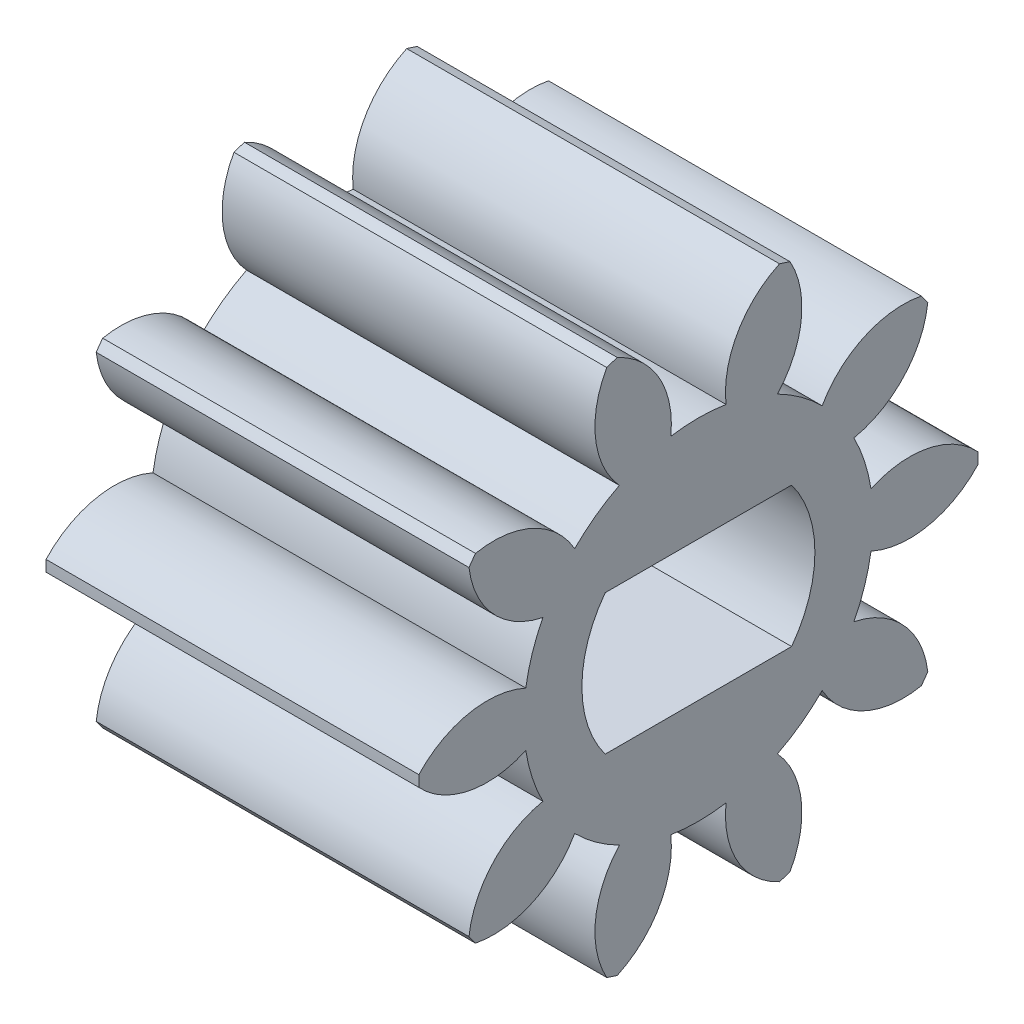
from build123d import *

# Parameters (mm, degrees)
BASPROSKE_W              = 8
BASPROSKE_H              = 6
TOOTHCUT_DEPTH           = 12.66190379
TEETHCUTS_COUNT          = 10
TEETHCUTS_ANGLE          = 324
BORSKE_R                 = 2.5
BORE_DEPTH               = 50.0000508
RESSALTO_EXTRUS_O3_DEPTH = 8


with BuildPart() as part:
    # BasProSke → Base-Revolve (revolve)
    with BuildSketch(Plane(origin=(0, 0, 0), x_dir=(1, 0, 0), z_dir=(0, 1, 0)), mode=Mode.PRIVATE) as base_revolve_sk:
        with Locations((4, 3)):
            Rectangle(BASPROSKE_W, BASPROSKE_H)
    revolve(base_revolve_sk.sketch.rotate(Axis((-10, 0, 0), (1, 0, 0)), 180), axis=Axis((-10, 0, 0), (1, 0, 0)))

    # TooCutSke → ToothCut (cut, through all)
    with BuildSketch(Plane(origin=(0, 0, 0), x_dir=(0, 0, -1), z_dir=(1, 0, 0))):
        with BuildLine():
            ThreePointArc((0.59278292, 3.701838653), (0, 3.749), (-0.59278292, 3.701838653))
            ThreePointArc((-0.59278292, 3.701838653), (-0.846593509, 4.924114224), (-1.775771316, 5.757784417))
            ThreePointArc((-1.775771316, 5.757784417), (0, 6.0254), (1.775771316, 5.757784417))
            ThreePointArc((1.775771316, 5.757784417), (0.846593509, 4.924114224), (0.59278292, 3.701838653))
        make_face()
    toothcut = extrude(amount=TOOTHCUT_DEPTH, mode=Mode.SUBTRACT)

    # TeethCuts: ToothCut ×10 about axis
    teethcuts_axis = Axis((-10, 0, 0), (1, 0, 0))
    for i in range(1, TEETHCUTS_COUNT):
        add(toothcut.rotate(teethcuts_axis, i * TEETHCUTS_ANGLE / (TEETHCUTS_COUNT - 1)), mode=Mode.SUBTRACT)

    # BorSke → Bore (cut, symmetric)
    with BuildSketch(Plane(origin=(0, 0, 0), x_dir=(0, 0, -1), z_dir=(1, 0, 0))):
        with Locations(Location((0, 0, 0), (0, 0, 180))):
            Circle(BORSKE_R)
    extrude(amount=BORE_DEPTH, both=True, mode=Mode.SUBTRACT)

    # Esboço1 → Ressalto-extrusão3 (add)
    with BuildSketch(Plane(origin=(8, 0, 0), x_dir=(0, 0, -1), z_dir=(1, 0, 0))):
        with BuildLine():
            ThreePointArc((2, 1.5), (0, 2.5), (-2, 1.5))
            Line((-2, 1.5), (2, 1.5))
        make_face()
        with BuildLine():
            Line((2, -1.5), (-2, -1.5))
            ThreePointArc((-2, -1.5), (0, -2.5), (2, -1.5))
        make_face()
    extrude(amount=-RESSALTO_EXTRUS_O3_DEPTH)


solid = part.part
